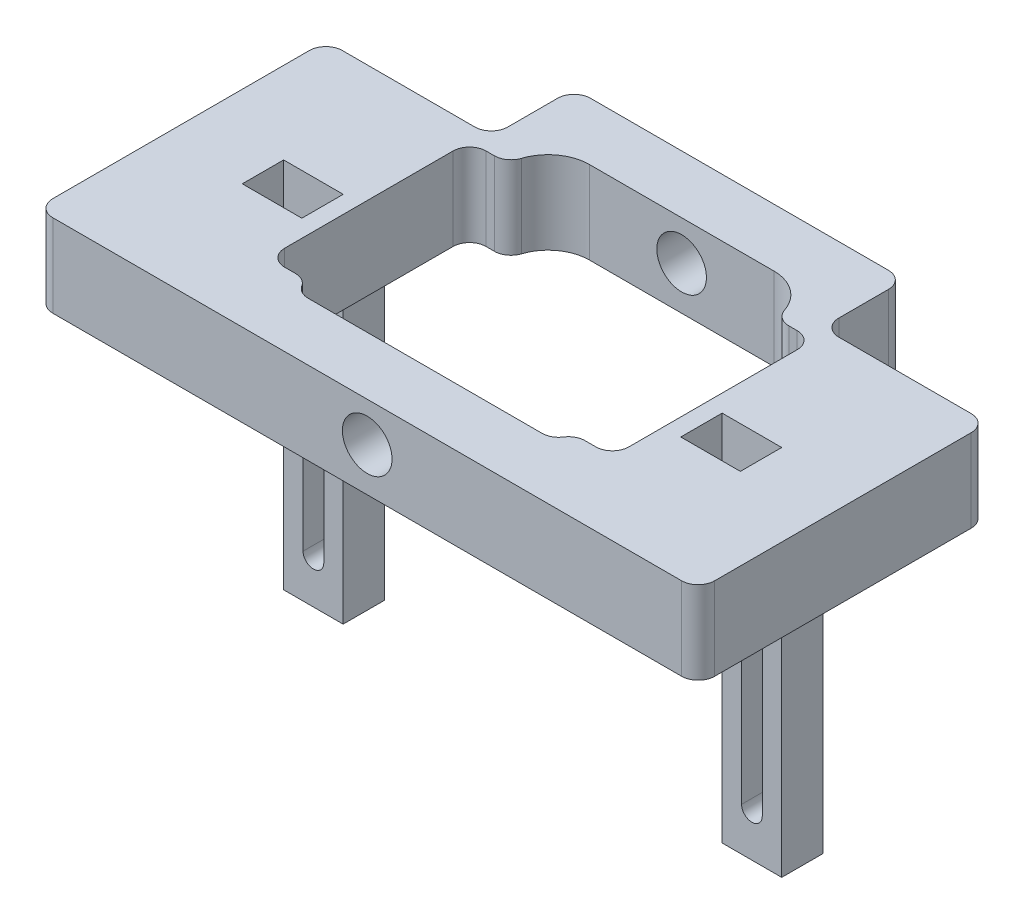
from build123d import *

# Parameters (mm, degrees)
SKETCH_1_W          = 80
SKETCH_1_H          = 35
EXTRUDE_1_DEPTH     = 10
SKETCH_2_W          = 7.2
SKETCH_2_H          = 5
SKETCH_2_H_2        = 5.001973484
CUT_EXTRUDE_1_DEPTH = 20
SKETCH_6_W          = 7.19
SKETCH_6_H          = 5
EXTRUDE_7_DEPTH     = 45
SKETCH_7_R          = 1.25
CUT_EXTRUDE_2_DEPTH = 30
SKETCH_8_W          = 40
SKETCH_8_H          = 10
EXTRUDE_8_DEPTH     = 10
SKETCH_10_W         = 32.274232457
SKETCH_10_H         = 31.000986742
CUT_EXTRUDE_3_DEPTH = 10
FILLET_1_R          = 5
FILLET_2_R          = 2
SKETCH_11_R         = 3
CUT_EXTRUDE_4_DEPTH = 50
CUT_EXTRUDE_5_DEPTH = 50
FILLET_3_R          = 2
SKETCH_13_W         = 7.18
SKETCH_13_H         = 2.109830921
EXTRUDE_9_DEPTH     = 10
SKETCH_14_W         = 41.600257034
SKETCH_14_H         = 24.338135392
CUT_EXTRUDE_6_DEPTH = 10
FILLET_5_R          = 2


with BuildPart() as part:
    # 草图1 → 凸台-拉伸1 (new body)
    with BuildSketch(Plane(origin=(0, 0, 0), x_dir=(1, 0, 0), z_dir=(0, 1, 0))):
        with Locations((21.527777778, -7.5)):
            Rectangle(SKETCH_1_W, SKETCH_1_H)
    extrude(amount=EXTRUDE_1_DEPTH)

    # 草图2 → 切除-拉伸1 (cut)
    with BuildSketch(Plane(origin=(0, 10, 0), x_dir=(1, 0, 0), z_dir=(0, 1, 0))):
        with Locations((-4.972222222, -7.500493371)):
            Rectangle(SKETCH_2_W, SKETCH_2_H)
        with Locations((48.027777778, -7.499506629)):
            Rectangle(SKETCH_2_W, SKETCH_2_H_2)
    extrude(amount=-CUT_EXTRUDE_1_DEPTH, mode=Mode.SUBTRACT)

    # 草图6 → 凸台-拉伸7 (add)
    with BuildSketch(Plane(origin=(0, 10, 0), x_dir=(1, 0, 0), z_dir=(0, 1, 0))):
        with Locations((-4.977222222, -2.500493371)):
            Rectangle(SKETCH_6_W, SKETCH_6_H)
        with Locations((48.032777778, -2.500493371)):
            Rectangle(SKETCH_6_W, SKETCH_6_H)
    extrude(amount=-EXTRUDE_7_DEPTH)

    # 草图7 → 切除-拉伸2 (cut)
    with BuildSketch(Plane.XY.offset(5.000493371)):
        with Locations((-4.972222222, -12)):
            Circle(SKETCH_7_R)
        with Locations((48.027777778, -12)):
            Circle(SKETCH_7_R)
    extrude(amount=-CUT_EXTRUDE_2_DEPTH, mode=Mode.SUBTRACT)

    # 草图8 → 凸台-拉伸8 (add)
    with BuildSketch(Plane(origin=(0, 0, -10), x_dir=(-1, 0, 0), z_dir=(0, 0, -1))):
        with Locations((-21.527777778, 5)):
            Rectangle(SKETCH_8_W, SKETCH_8_H)
    extrude(amount=EXTRUDE_8_DEPTH)

    # 草图10 → 切除-拉伸3 (cut)
    with BuildSketch(Plane(origin=(0, 10, 0), x_dir=(1, 0, 0), z_dir=(0, 1, 0))):
        with Locations((21.527777778, -2.5)):
            Rectangle(SKETCH_10_W, SKETCH_10_H)
    extrude(amount=-CUT_EXTRUDE_3_DEPTH, mode=Mode.SUBTRACT)

    # 圆角1
    fillet_1_edges = [part.edges().sort_by_distance(p)[0] for p in [
        (37.664894006, 5, -13.000493371),
        (5.390661549, 5, -13.000493371),
    ]]
    fillet(fillet_1_edges, radius=FILLET_1_R)

    # 圆角2
    fillet_2_edges = [part.edges().sort_by_distance(p)[0] for p in [
        (37.664894006, 5, 18.000493371),
        (5.390661549, 5, 18.000493371),
    ]]
    fillet(fillet_2_edges, radius=FILLET_2_R)

    # 草图11 → 切除-拉伸4 (cut)
    with BuildSketch(Plane.XY.offset(25)):
        with Locations(Location((21.527777778, 5.231122454, 0), (0, 0, 180))):
            Circle(SKETCH_11_R)
    extrude(amount=-CUT_EXTRUDE_4_DEPTH, mode=Mode.SUBTRACT)

    # 草图12 → 切除-拉伸5 (cut)
    with BuildSketch(Plane.XY.offset(5.000493371)):
        with BuildLine():
            Line((-3.722222222, -9.086156221), (-3.722222222, -29.777694538))
            ThreePointArc((-3.722222222, -29.777694538), (-4.972222222, -31.027694538), (-6.222222222, -29.777694538))
            Line((-6.222222222, -29.777694538), (-6.222222222, -9.086156221))
            ThreePointArc((-6.222222222, -9.086156221), (-4.972222222, -7.836156221), (-3.722222222, -9.086156221))
        make_face()
        with BuildLine():
            Line((46.777777778, -9.086156221), (46.777777778, -29.777694538))
            ThreePointArc((46.777777778, -29.777694538), (48.027777778, -31.027694538), (49.277777778, -29.777694538))
            Line((49.277777778, -29.777694538), (49.277777778, -9.086156221))
            ThreePointArc((49.277777778, -9.086156221), (48.027777778, -7.836156221), (46.777777778, -9.086156221))
        make_face()
    extrude(amount=-CUT_EXTRUDE_5_DEPTH, mode=Mode.SUBTRACT)

    # 圆角3
    fillet_3_edges = [part.edges().sort_by_distance(p)[0] for p in [
        (41.527777778, 5, -10),
        (1.527777778, 5, -10),
        (41.527777778, 5, -20),
        (1.527777778, 5, -20),
        (61.527777778, 5, 25),
        (-18.472222222, 5, 25),
        (-18.472222222, 5, -10),
        (61.527777778, 5, -10),
    ]]
    fillet(fillet_3_edges, radius=FILLET_3_R)

    # 草图13 → 凸台-拉伸9 (add)
    with BuildSketch(Plane.XZ):
        with Locations((-4.972222222, 13.322503868)):
            Rectangle(SKETCH_13_W, SKETCH_13_H)
    extrude(amount=EXTRUDE_9_DEPTH)

    # 草图14 → 切除-拉伸6 (cut)
    with BuildSketch(Plane(origin=(0, 10, 0), x_dir=(1, 0, 0), z_dir=(0, 1, 0))):
        with Locations((21.527777778, -4)):
            Rectangle(SKETCH_14_W, SKETCH_14_H)
    extrude(amount=-CUT_EXTRUDE_6_DEPTH, mode=Mode.SUBTRACT)

    # 圆角5
    fillet_5_edges = [part.edges().sort_by_distance(p)[0] for p in [
        (5.397778538, 5, 16.169067696),
        (5.393504088, 5, -8.169067696),
        (37.662051468, 5, -8.169067696),
        (0.727649261, 5, -8.169067696),
        (37.657777017, 5, 16.169067696),
        (42.327906295, 5, 16.169067696),
        (0.727649261, 5, 16.169067696),
        (42.327906295, 5, -8.169067696),
    ]]
    fillet(fillet_5_edges, radius=FILLET_5_R)


solid = part.part
